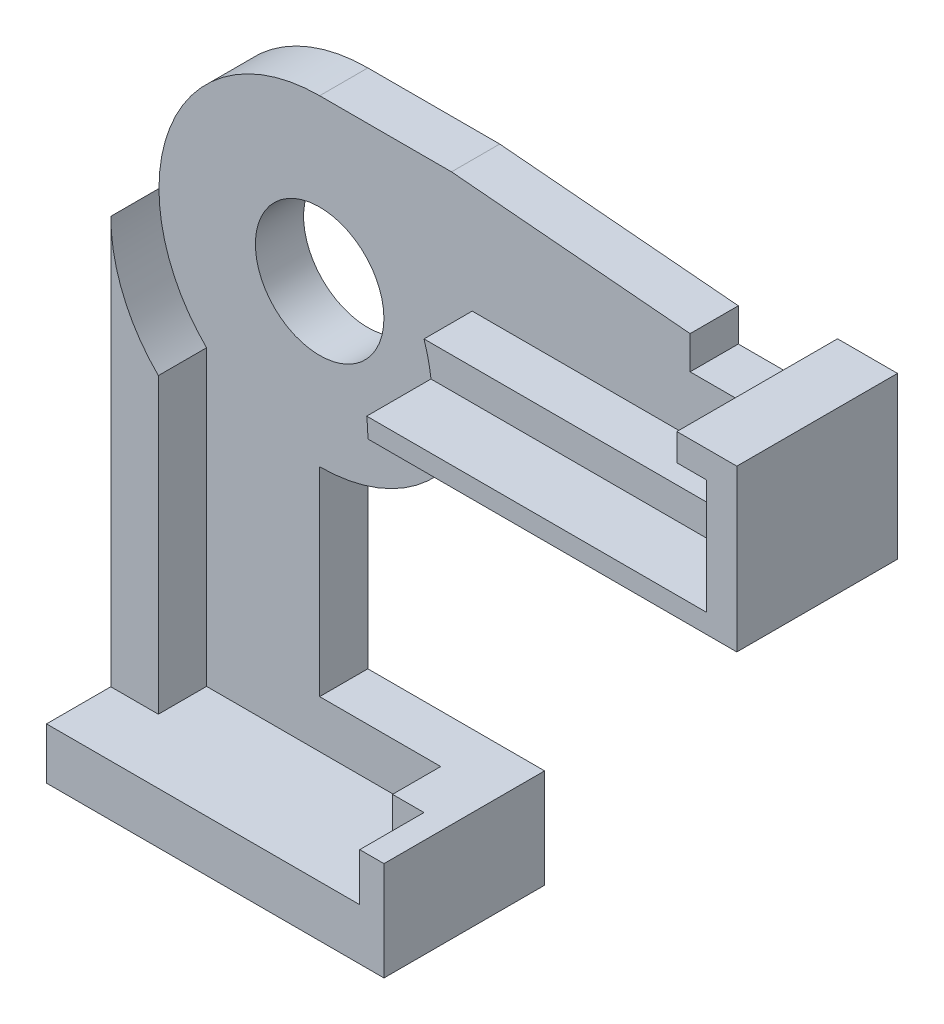
from build123d import *

# Parameters (mm, degrees)
SKETCH_1_R      = 2
EXTRUDE_1_DEPTH = 1.5
SKETCH_1_3_W    = 0.979922275
SKETCH_1_3_H    = 1.483986981
EXTRUDE_2_DEPTH = 3
EXTRUDE_3_DEPTH = 5


with BuildPart() as part:
    # 스케치1 → 보스-돌출1 (new body)
    with BuildSketch(Plane.XY):
        with BuildLine():
            Line((4.103232797, 5), (0, 5))
            ThreePointArc((0, 5), (-4.623797936, 1.902759219), (-3.51918966, -3.551802942))
            Line((-3.51918966, -3.551802942), (-3.51918966, -12.678202106))
            Line((-3.51918966, -12.678202106), (3.767394394, -12.678202106))
            Line((3.767394394, -12.678202106), (3.767394394, -11.194215125))
            Line((3.767394394, -11.194215125), (0, -11.194215125))
            Line((0, -11.194215125), (0, -5))
            ThreePointArc((0, -5), (4.052588627, -2.928570542), (4.747316669, 1.569389833))
            Line((4.747316669, 1.569389833), (14.616295983, 1.569389833))
            Line((14.616295983, 1.569389833), (14.616295983, 3.323351723))
            Line((14.616295983, 3.323351723), (11.529062921, 3.323351723))
            Line((11.529062921, 3.323351723), (11.529062921, 4.354010329))
            Line((11.529062921, 4.354010329), (4.103232797, 5))
        make_face()
        Circle(SKETCH_1_R, mode=Mode.SUBTRACT)
    extrude(amount=EXTRUDE_1_DEPTH)

    # 스케치1<3> → 보스-돌출2 (add)
    with BuildSketch(Plane.XY):
        with BuildLine():
            Line((14.616295983, 1.569389833), (4.747316669, 1.569389833))
            ThreePointArc((4.747316669, 1.569389833), (4.880000714, 1.088849406), (4.964172837, 0.597484763))
            Line((4.964172837, 0.597484763), (15.542189383, 0.597484763))
            Line((15.542189383, 0.597484763), (15.542189383, 4.165774783))
            Line((15.542189383, 4.165774783), (14.616295983, 4.165774783))
            Line((14.616295983, 4.165774783), (14.616295983, 1.569389833))
        make_face()
        with BuildLine():
            ThreePointArc((-3.51918966, -3.551802942), (-4.614972822, -1.924064929), (-5, 0))
            Line((-5, 0), (-5, -12.678202106))
            Line((-5, -12.678202106), (-3.51918966, -12.678202106))
            Line((-3.51918966, -12.678202106), (-3.51918966, -3.551802942))
        make_face()
        with Locations((4.257355532, -11.936208616)):
            Rectangle(SKETCH_1_3_W, SKETCH_1_3_H)
    extrude(amount=EXTRUDE_2_DEPTH)

    # 스케치1<4> → 보스-돌출3 (add)
    with BuildSketch(Plane.XY):
        with BuildLine():
            Line((15.542189383, 0.597484763), (4.964172837, 0.597484763))
            ThreePointArc((4.964172837, 0.597484763), (4.991035173, 0.299278978), (5, 0))
            Line((5, 0), (16.481935348, 0))
            Line((16.481935348, 0), (16.481935348, 5.008197844))
            Line((16.481935348, 5.008197844), (14.616295983, 5.008197844))
            Line((14.616295983, 5.008197844), (14.616295983, 4.165774783))
            Line((14.616295983, 4.165774783), (15.542189383, 4.165774783))
            Line((15.542189383, 4.165774783), (15.542189383, 0.597484763))
        make_face()
        Polygon((4.747316669, -12.678202106), (-5, -12.678202106), (-5, -14.27668016), (5.501186974, -14.27668016), (5.501186974, -11.194215125), (4.747316669, -11.194215125), align=None)
    extrude(amount=EXTRUDE_3_DEPTH)


solid = part.part
